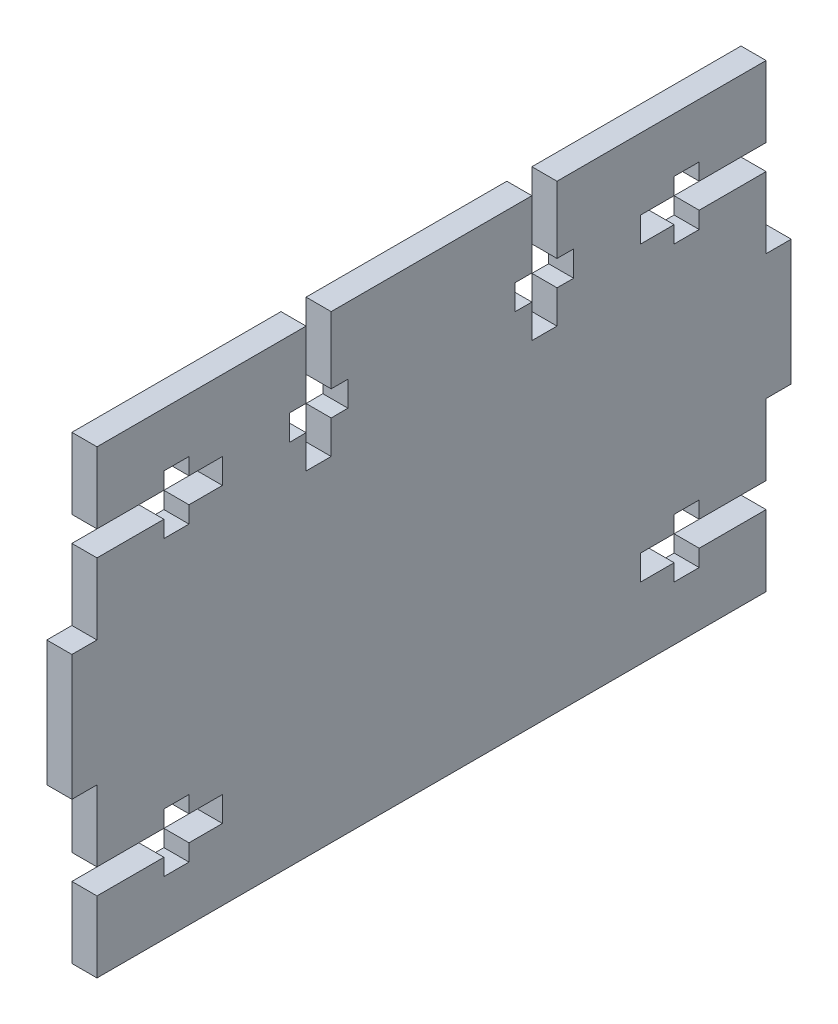
from build123d import *

# Parameters (mm, degrees)
SALIENTE_EXTRUIR1_DEPTH = 3
CORTAR_EXTRUIR1_DEPTH   = 10


with BuildPart() as part:
    # Croquis1 → Saliente-Extruir1 (new body)
    with BuildSketch(Plane(origin=(0, 0, 0), x_dir=(0, 0, -1), z_dir=(1, 0, 0))):
        Polygon((-40, 0), (40, 0), (40, -20), (43, -20), (43, -35), (40, -35), (40, -55), (-40, -55), (-40, -35), (-43, -35), (-43, -20), (-40, -20), align=None)
    extrude(amount=SALIENTE_EXTRUIR1_DEPTH)

    # Croquis2 → Cortar-Extruir1 (cut)
    with BuildSketch(Plane.ZY):
        Polygon((-40, -8.5), (-32, -8.5), (-32, -6.5), (-29, -6.5), (-29, -8.5), (-25, -8.5), (-25, -11.5), (-29, -11.5), (-29, -13.5), (-32, -13.5), (-32, -11.5), (-40, -11.5), align=None)
        Polygon((29, -11.5), (25, -11.5), (25, -8.5), (29, -8.5), (29, -6.5), (32, -6.5), (32, -8.5), (40, -8.5), (40, -11.5), (32, -11.5), (32, -13.5), (29, -13.5), align=None)
        Polygon((-12, 0), (-12, -8), (-10, -8), (-10, -11), (-12, -11.013841386), (-12, -15), (-15, -15), (-15, -11.034603466), (-17, -11.048444852), (-17, -8), (-15, -8), (-15, 0), align=None)
        Polygon((15, -11.034603466), (15, -15), (12, -15), (12, -11.013841386), (10, -11), (10, -8), (12, -8), (12, 0), (15, 0), (15, -8), (17, -8), (17, -11.048444852), align=None)
        Polygon((40, -46.5), (32, -46.5), (32, -48.5), (29, -48.5), (29, -46.5), (25, -46.5), (25, -43.5), (29, -43.5), (29, -41.5), (32, -41.5), (32, -43.5), (40, -43.5), align=None)
        Polygon((-29, -43.5), (-25, -43.5), (-25, -46.5), (-29, -46.5), (-29, -48.5), (-32, -48.5), (-32, -46.5), (-40, -46.5), (-40, -43.5), (-32, -43.5), (-32, -41.5), (-29, -41.5), align=None)
    extrude(amount=-CORTAR_EXTRUIR1_DEPTH, mode=Mode.SUBTRACT)


solid = part.part
